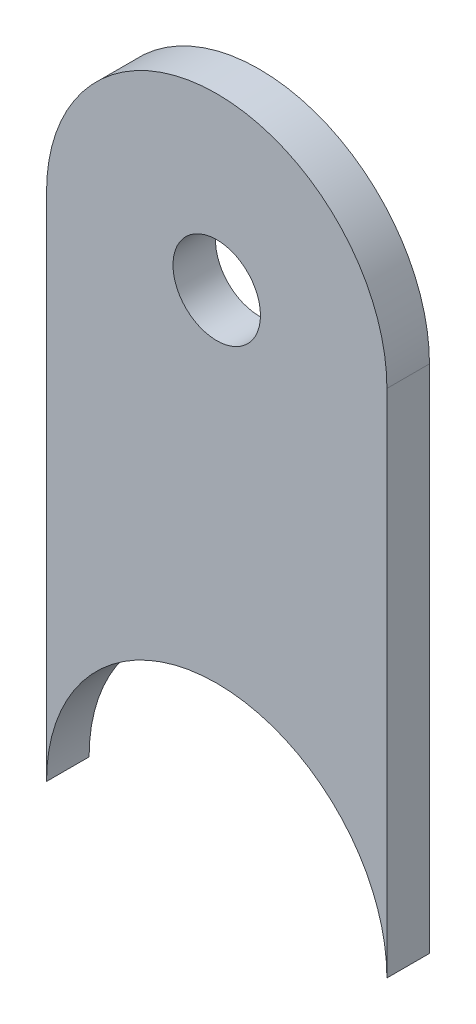
from build123d import *

# Parameters (mm, degrees)
BOSS_EXTRUDE1_DEPTH = 3.175


with BuildPart() as part:
    # Sketch1 → Boss-Extrude1 (new body)
    with BuildSketch(Plane.XY):
        with BuildLine():
            Line((0, 38.1), (0, 0))
            ThreePointArc((0, 0), (3.719743879, 8.980256121), (12.7, 12.7))
            ThreePointArc((12.7, 12.7), (21.680256121, 8.980256121), (25.4, 0))
            Line((25.4, 0), (25.4, 38.1))
            ThreePointArc((25.4, 38.1), (12.7, 50.8), (0, 38.1))
        make_face()
        with BuildLine():
            ThreePointArc((15.9639, 38.1), (15.007925823, 35.792074177), (12.7, 34.8361))
            ThreePointArc((12.7, 34.8361), (10.392074177, 40.407925823), (15.9639, 38.1))
        make_face(mode=Mode.SUBTRACT)
    extrude(amount=BOSS_EXTRUDE1_DEPTH)


solid = part.part
